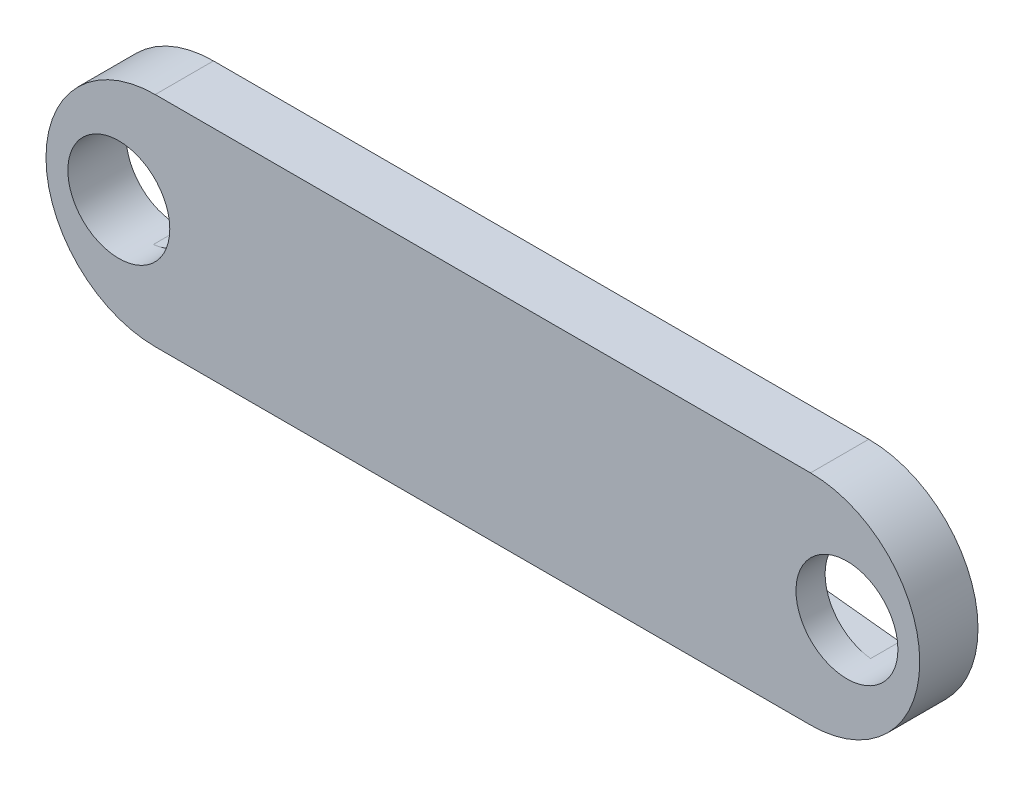
from build123d import *

# Parameters (mm, degrees)
SKETCH1_W           = 60
SKETCH1_H           = 15
SKETCH1_R           = 1
BOSS_EXTRUDE1_DEPTH = 4
FILLET1_RADIUS      = 7.5
FILLET1_LENGTH      = 4
FILLET2_RADIUS      = 7.5
FILLET2_LENGTH      = 4
CUT_EXTRUDE1_DEPTH  = 2
SKETCH4_R           = 3.5
CUT_EXTRUDE2_DEPTH  = 6
CUT_EXTRUDE3_DEPTH  = 2
SKETCH6_R           = 3.5
CUT_EXTRUDE4_DEPTH  = 6


with BuildPart() as part:
    # Sketch1 → Boss-Extrude1 (new body)
    with BuildSketch(Plane.XY):
        with Locations((-25, 9.186746988)):
            Rectangle(SKETCH1_W, SKETCH1_H)
        with Locations((-50, 9.186746988)):
            Circle(SKETCH1_R, mode=Mode.SUBTRACT)
        with Locations((0, 9.186746988)):
            Circle(SKETCH1_R, mode=Mode.SUBTRACT)
    extrude(amount=BOSS_EXTRUDE1_DEPTH)

    # Fillet1: full round fillet: the end face becomes a half cylinder, R = half its width
    fillet1_face = Plane((5, 9.186746988, 2), x_dir=(0, 0, -1), z_dir=(1, 0, 0))  # on the end face: x along it, z out of the body
    fillet1_slab = fillet1_face.offset(-FILLET1_RADIUS / 2) * Box(FILLET1_LENGTH, 2 * FILLET1_RADIUS, FILLET1_RADIUS, mode=Mode.PRIVATE)  # the body's end, R deep
    fillet1_round = Plane((-2.5, 9.186746988, 2), x_dir=(1, 0, 0), z_dir=(0, 0, -1)) * Cylinder(FILLET1_RADIUS, FILLET1_LENGTH, mode=Mode.PRIVATE)  # its axis R under the face
    add(fillet1_slab - fillet1_round, mode=Mode.SUBTRACT)

    # Fillet2: full round fillet: the end face becomes a half cylinder, R = half its width
    fillet2_face = Plane((-55, 9.186746988, 2), x_dir=(0, 0, 1), z_dir=(-1, 0, 0))  # on the end face: x along it, z out of the body
    fillet2_slab = fillet2_face.offset(-FILLET2_RADIUS / 2) * Box(FILLET2_LENGTH, 2 * FILLET2_RADIUS, FILLET2_RADIUS, mode=Mode.PRIVATE)  # the body's end, R deep
    fillet2_round = Plane((-47.5, 9.186746988, 2), x_dir=(-1, 0, 0), z_dir=(0, 0, 1)) * Cylinder(FILLET2_RADIUS, FILLET2_LENGTH, mode=Mode.PRIVATE)  # its axis R under the face
    add(fillet2_slab - fillet2_round, mode=Mode.SUBTRACT)

    # Sketch3 → Cut-Extrude1 (cut)
    with BuildSketch(Plane(origin=(0, 0, 0), x_dir=(-1, 0, 0), z_dir=(0, 0, -1))):
        with BuildLine():
            Line((14.214285714, 11.17523426), (0.375, 12.666599715))
            ThreePointArc((0.375, 12.666599715), (-3.5, 9.186746988), (0.375, 5.706894261))
            Line((0.375, 5.706894261), (14.214285714, 7.198259716))
            ThreePointArc((14.214285714, 7.198259716), (16, 9.186746988), (14.214285714, 11.17523426))
        make_face()
    extrude(amount=-CUT_EXTRUDE1_DEPTH, mode=Mode.SUBTRACT)

    # Sketch4 → Cut-Extrude2 (cut)
    with BuildSketch(Plane(origin=(0, 0, 2), x_dir=(-1, 0, 0), z_dir=(0, 0, -1))):
        with Locations(Location((0, 9.186746988, 0), (0, 0, 276.150639828))):
            Circle(SKETCH4_R)
    extrude(amount=-CUT_EXTRUDE2_DEPTH, mode=Mode.SUBTRACT)

    # Sketch5 → Cut-Extrude3 (cut)
    with BuildSketch(Plane(origin=(0, 0, 0), x_dir=(-1, 0, 0), z_dir=(0, 0, -1))):
        with BuildLine():
            Line((49.625, 12.666599715), (35.785714286, 11.17523426))
            ThreePointArc((35.785714286, 11.17523426), (34, 9.186746988), (35.785714286, 7.198259716))
            Line((35.785714286, 7.198259716), (49.625, 5.706894261))
            ThreePointArc((49.625, 5.706894261), (53.5, 9.186746988), (49.625, 12.666599715))
        make_face()
    extrude(amount=-CUT_EXTRUDE3_DEPTH, mode=Mode.SUBTRACT)

    # Sketch6 → Cut-Extrude4 (cut)
    with BuildSketch(Plane(origin=(0, 0, 0), x_dir=(-1, 0, 0), z_dir=(0, 0, -1))):
        with Locations(Location((50, 9.186746988, 0), (0, 0, 96.150639828))):
            Circle(SKETCH6_R)
    extrude(amount=-CUT_EXTRUDE4_DEPTH, mode=Mode.SUBTRACT)


solid = part.part
